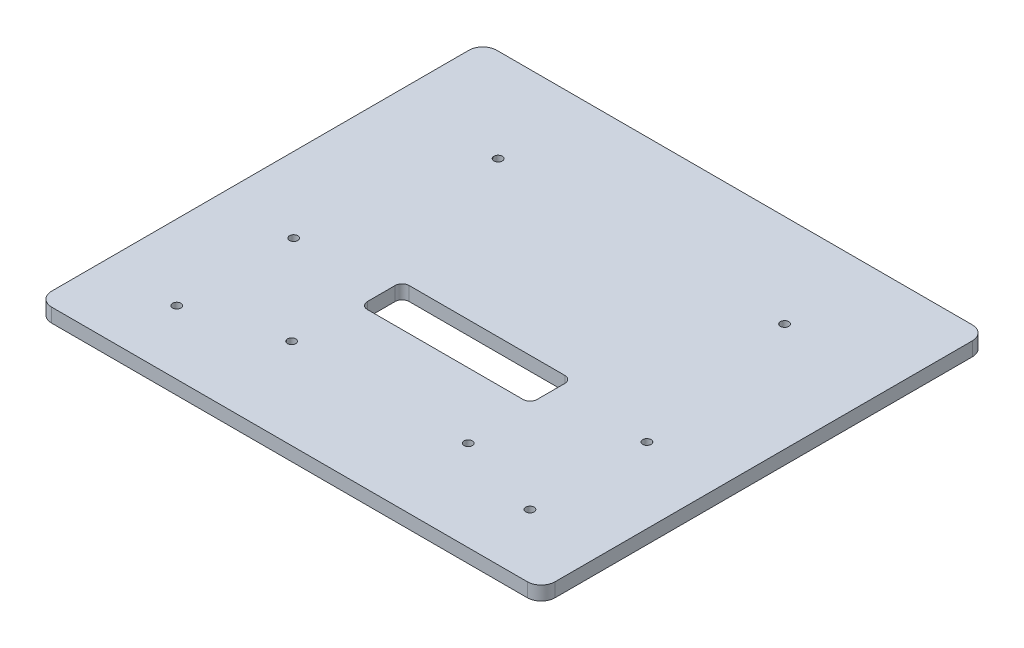
from build123d import *

# Parameters (mm, degrees)
RESSALTO_EXTRUS_O1_DEPTH = 5
ESBO_O2_R                = 1.5
CORTE_EXTRUS_O1_DEPTH    = 5
ESBO_O3_R                = 1.5
CORTE_EXTRUS_O2_DEPTH    = 10
CORTE_EXTRUS_O3_DEPTH    = 10


with BuildPart() as part:
    # Esboço1 → Ressalto-extrusão1 (new body)
    with BuildSketch(Plane(origin=(0, 0, 0), x_dir=(1, 0, 0), z_dir=(0, 1, 0))):
        with BuildLine():
            Line((-61.865783789, 131.661644013), (109.134216211, 131.661644013))
            ThreePointArc((109.134216211, 131.661644013), (112.669750117, 130.197177919), (114.134216211, 126.661644013))
            Line((114.134216211, 126.661644013), (114.134216211, -23.338355987))
            ThreePointArc((114.134216211, -23.338355987), (112.669750117, -26.873889893), (109.134216211, -28.338355987))
            Line((109.134216211, -28.338355987), (-61.865783789, -28.338355987))
            ThreePointArc((-61.865783789, -28.338355987), (-65.401317695, -26.873889893), (-66.865783789, -23.338355987))
            Line((-66.865783789, -23.338355987), (-66.865783789, 126.661644013))
            ThreePointArc((-66.865783789, 126.661644013), (-65.401317695, 130.197177919), (-61.865783789, 131.661644013))
        make_face()
    extrude(amount=RESSALTO_EXTRUS_O1_DEPTH)

    # Esboço2 → Corte-extrusão1 (cut)
    with BuildSketch(Plane(origin=(0, 5, 0), x_dir=(1, 0, 0), z_dir=(0, 1, 0))):
        with Locations(Location((-27.865783789, 98.161644013, 0), (0, 0, 270))):
            Circle(ESBO_O2_R)
        with Locations(Location((75.134216211, 98.161644013, 0), (0, 0, 270))):
            Circle(ESBO_O2_R)
        with Locations(Location((-8.115783789, 4.161644013, 0), (0, 0, 270))):
            Circle(ESBO_O2_R)
        with Locations(Location((55.384216211, 4.161644013, 0), (0, 0, 270))):
            Circle(ESBO_O2_R)
    extrude(amount=-CORTE_EXTRUS_O1_DEPTH, mode=Mode.SUBTRACT)

    # Esboço3 → Corte-extrusão2 (cut)
    with BuildSketch(Plane(origin=(0, 5, 0), x_dir=(1, 0, 0), z_dir=(0, 1, 0))):
        with Locations(Location((-39.865783789, 36.661644013, 0), (0, 0, 270))):
            Circle(ESBO_O3_R)
        with Locations(Location((-39.865783789, -5.388355987, 0), (0, 0, 270))):
            Circle(ESBO_O3_R)
        with Locations(Location((87.134216211, 36.661644013, 0), (0, 0, 270))):
            Circle(ESBO_O3_R)
        with Locations(Location((87.134216211, -5.388355987, 0), (0, 0, 270))):
            Circle(ESBO_O3_R)
    extrude(amount=-CORTE_EXTRUS_O2_DEPTH, mode=Mode.SUBTRACT)

    # Esboço4 → Corte-extrusão3 (cut)
    with BuildSketch(Plane(origin=(0, 5, 0), x_dir=(1, 0, 0), z_dir=(0, 1, 0))):
        with BuildLine():
            Line((-4.365783789, 42.661644013), (51.634216211, 42.661644013))
            ThreePointArc((51.634216211, 42.661644013), (53.401983164, 41.929410966), (54.134216211, 40.161644013))
            Line((54.134216211, 40.161644013), (54.134216211, 30.161644013))
            ThreePointArc((54.134216211, 30.161644013), (53.401983164, 28.39387706), (51.634216211, 27.661644013))
            Line((51.634216211, 27.661644013), (-4.365783789, 27.661644013))
            ThreePointArc((-4.365783789, 27.661644013), (-6.133550742, 28.39387706), (-6.865783789, 30.161644013))
            Line((-6.865783789, 30.161644013), (-6.865783789, 40.161644013))
            ThreePointArc((-6.865783789, 40.161644013), (-6.133550742, 41.929410966), (-4.365783789, 42.661644013))
        make_face()
    extrude(amount=-CORTE_EXTRUS_O3_DEPTH, mode=Mode.SUBTRACT)


solid = part.part
